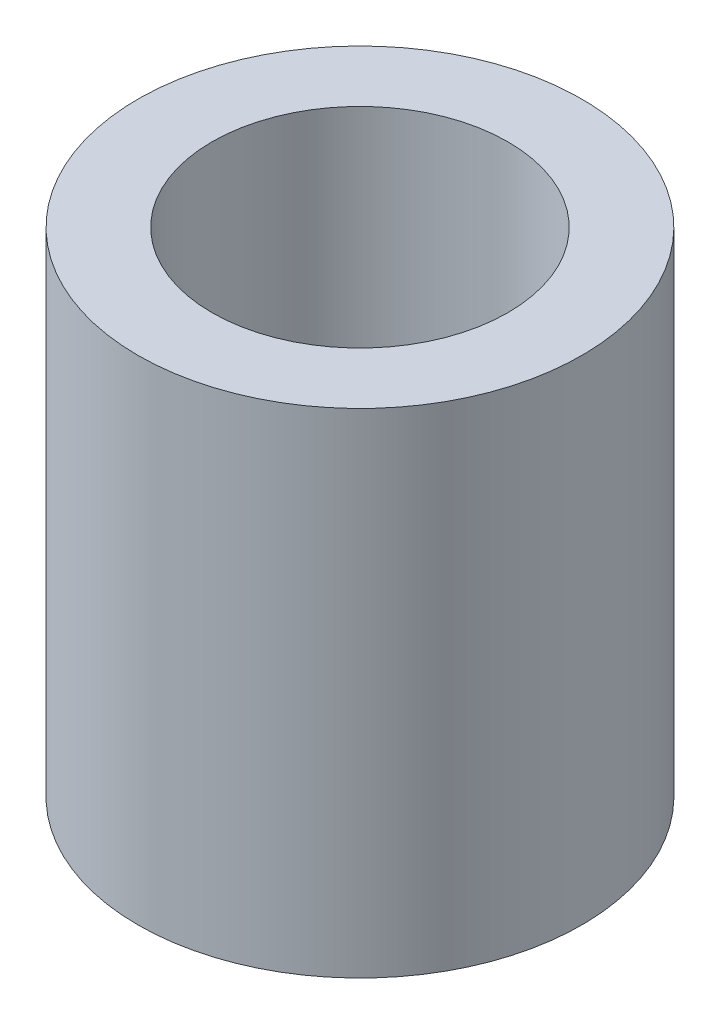
from build123d import *

# Parameters (mm, degrees)
SKETCH1_R           = 4.5
SKETCH1_R_2         = 3
BOSS_EXTRUDE3_DEPTH = 10


with BuildPart() as part:
    # Sketch1 → Boss-Extrude3 (new body)
    with BuildSketch(Plane(origin=(0, 0, 0), x_dir=(1, 0, 0), z_dir=(0, 1, 0))):
        with Locations(Location((0, 0, 0), (0, 0, 270))):
            Circle(SKETCH1_R)
        with Locations(Location((0, 0, 0), (0, 0, 270))):
            Circle(SKETCH1_R_2, mode=Mode.SUBTRACT)
    extrude(amount=BOSS_EXTRUDE3_DEPTH)


solid = part.part
